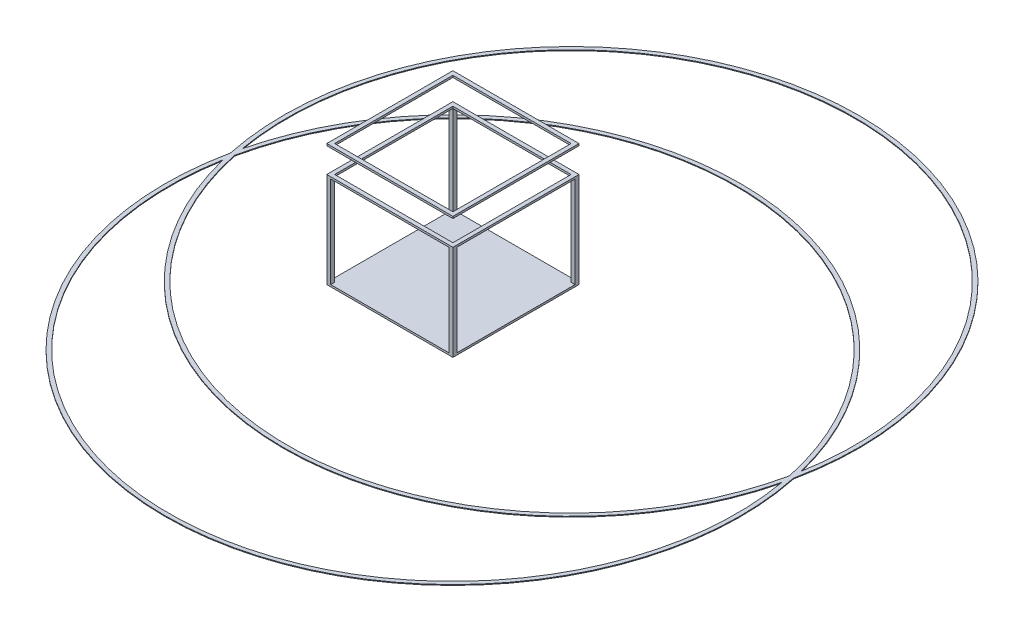
from build123d import *

# Parameters (mm, degrees)
SKETCH1_W           = 406.4
SKETCH1_H           = 406.4
BOSS_EXTRUDE1_DEPTH = 6.35
SKETCH2_W           = 12.7
SKETCH2_H           = 12.7
BOSS_EXTRUDE2_DEPTH = 294.64
SKETCH3_W           = 406.4
SKETCH3_H           = 406.4
SKETCH3_W_2         = 381
SKETCH3_H_2         = 381
BOSS_EXTRUDE3_DEPTH = 6.35
SKETCH5_W           = 406.4
SKETCH5_H           = 406.4
SKETCH5_W_2         = 381
SKETCH5_H_2         = 381
BOSS_EXTRUDE4_DEPTH = 6.35
SKETCH8_R           = 927.1
SKETCH8_R_2         = 914.4
BOSS_EXTRUDE8_DEPTH = 2.54


with BuildPart() as part:
    # Sketch1 → Boss-Extrude1 (new body)
    with BuildSketch(Plane(origin=(0, 0, 0), x_dir=(1, 0, 0), z_dir=(0, 1, 0))):
        Rectangle(SKETCH1_W, SKETCH1_H)
    extrude(amount=BOSS_EXTRUDE1_DEPTH)

    # Sketch2 → Boss-Extrude2 (add)
    with BuildSketch(Plane(origin=(0, 6.35, 0), x_dir=(1, 0, 0), z_dir=(0, 1, 0))):
        with Locations((-196.85, -196.85)):
            Rectangle(SKETCH2_W, SKETCH2_H)
        with Locations((196.85, -196.85)):
            Rectangle(SKETCH2_W, SKETCH2_H)
        with Locations((-196.85, 196.85)):
            Rectangle(SKETCH2_W, SKETCH2_H)
        with Locations((196.85, 196.85)):
            Rectangle(SKETCH2_W, SKETCH2_H)
    extrude(amount=BOSS_EXTRUDE2_DEPTH)

    # Sketch3 → Boss-Extrude3 (add)
    with BuildSketch(Plane(origin=(0, 300.99, 0), x_dir=(1, 0, 0), z_dir=(0, 1, 0))):
        Rectangle(SKETCH3_W, SKETCH3_H)
        Rectangle(SKETCH3_W_2, SKETCH3_H_2, mode=Mode.SUBTRACT)
    extrude(amount=BOSS_EXTRUDE3_DEPTH)


with BuildPart() as body_2:
    # Sketch5 → Boss-Extrude4 (new body)
    with BuildSketch(Plane(origin=(0, 387.35, 0), x_dir=(1, 0, 0), z_dir=(0, 1, 0))):
        Rectangle(SKETCH5_W, SKETCH5_H)
        Rectangle(SKETCH5_W_2, SKETCH5_H_2, mode=Mode.SUBTRACT)
    extrude(amount=BOSS_EXTRUDE4_DEPTH)


with BuildPart() as body_3:
    # Sketch8 → Boss-Extrude8 (new body)
    # profile 1 of 2: a face of its own
    with BuildSketch(Plane(origin=(0, 6.35, 0), x_dir=(1, 0, 0), z_dir=(0, 1, 0))):
        with Locations((190.5, 190.5)):
            Circle(SKETCH8_R)
        with Locations((190.5, 190.5)):
            Circle(SKETCH8_R_2, mode=Mode.SUBTRACT)
    # profile 2 of 2: a face of its own
    with BuildSketch(Plane(origin=(0, 6.35, 0), x_dir=(1, 0, 0), z_dir=(0, 1, 0))):
        with Locations((190.5, -190.5)):
            Circle(SKETCH8_R)
        with Locations((190.5, -190.5)):
            Circle(SKETCH8_R_2, mode=Mode.SUBTRACT)
    extrude(amount=BOSS_EXTRUDE8_DEPTH)


solid = Compound([part.part, body_2.part, body_3.part])
